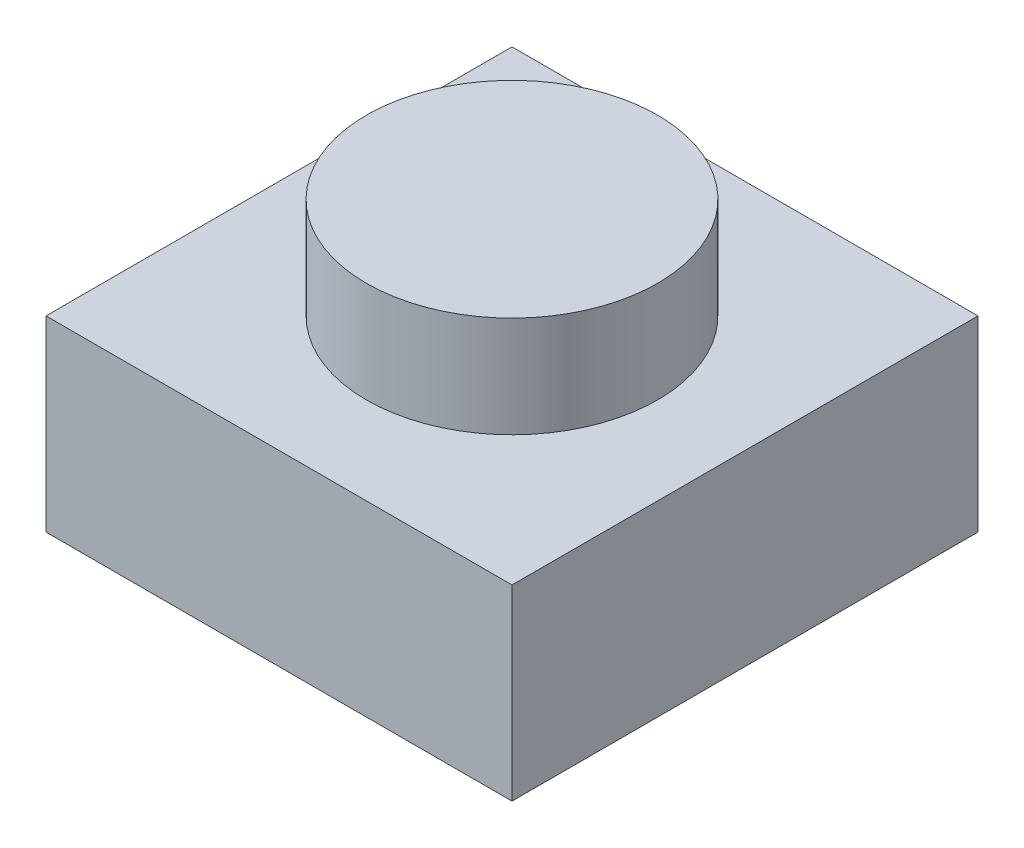
from build123d import *

# Parameters (mm, degrees)
SKETCH3_W           = 7.84
SKETCH3_H           = 7.84
BOSS_EXTRUDE1_DEPTH = 3.15
SKETCH4_R           = 2.45
BOSS_EXTRUDE2_DEPTH = 1.7
SHELL1_T            = -1.5


with BuildPart() as part:
    # Sketch3 → Boss-Extrude1 (new body)
    with BuildSketch(Plane(origin=(0, 0, 0), x_dir=(1, 0, 0), z_dir=(0, 1, 0))):
        Rectangle(SKETCH3_W, SKETCH3_H)
    extrude(amount=-BOSS_EXTRUDE1_DEPTH)

    # Sketch4 → Boss-Extrude2 (add)
    with BuildSketch(Plane(origin=(0, 0, 0), x_dir=(1, 0, 0), z_dir=(0, 1, 0))):
        with Locations(Location((0, 0, 0), (0, 0, 270))):
            Circle(SKETCH4_R)
    extrude(amount=BOSS_EXTRUDE2_DEPTH)

    # Shell1
    shell1_openings = [part.faces().sort_by_distance(p)[0] for p in [
        (0, -3.15, 0),
    ]]
    offset(amount=SHELL1_T, openings=shell1_openings, kind=Kind.INTERSECTION)


solid = part.part
